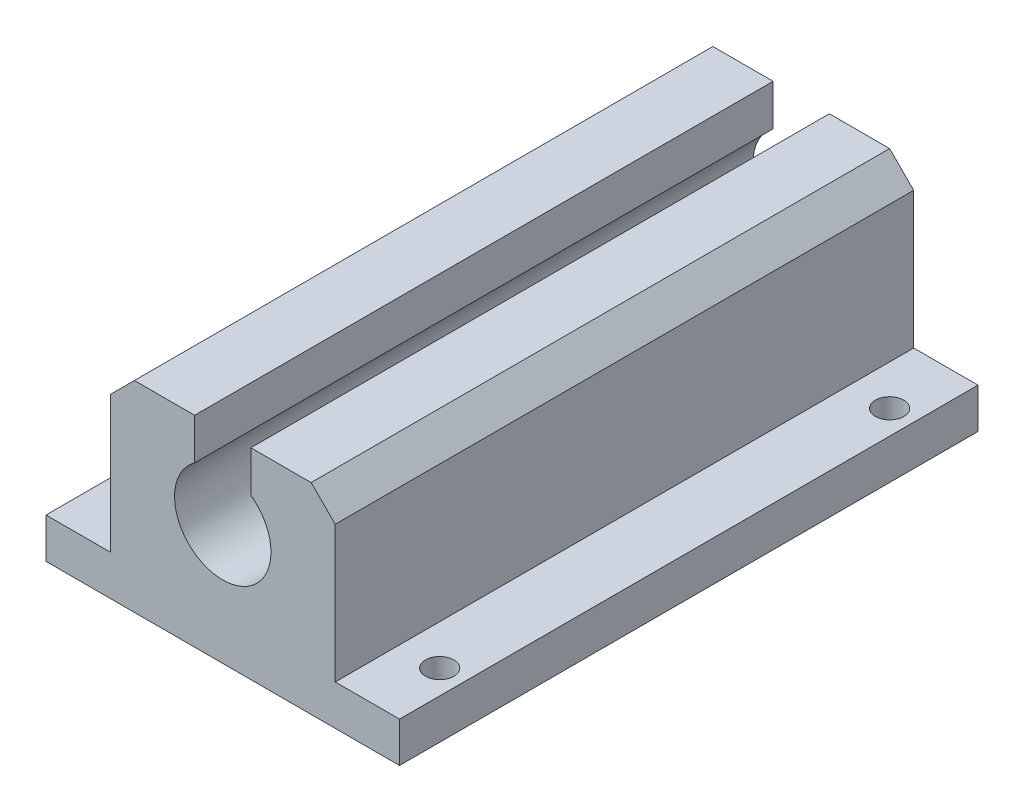
from build123d import *

# Parameters (mm, degrees)
EXTRUDE1_DEPTH         = 57.15
F_10_CLEARANCE_HOLE1_D = 5.6134
CHAMFER1_SIZE          = 4.7625


with BuildPart() as part:
    # Sketch1 → Extrude1 (new, symmetric)
    with BuildSketch(Plane.XY):
        with BuildLine():
            Line((22.225, 15.875), (5.55625, 15.875))
            Line((5.55625, 15.875), (5.55625, 7.736518011))
            ThreePointArc((5.55625, 7.736518011), (0, -9.525), (-5.55625, 7.736518011))
            Line((-5.55625, 7.736518011), (-5.55625, 15.875))
            Line((-5.55625, 15.875), (-22.225, 15.875))
            Line((-22.225, 15.875), (-22.225, -15.875))
            Line((-22.225, -15.875), (-34.925, -15.875))
            Line((-34.925, -15.875), (-34.925, -23.8125))
            Line((-34.925, -23.8125), (34.925, -23.8125))
            Line((34.925, -23.8125), (34.925, -15.875))
            Line((34.925, -15.875), (22.225, -15.875))
            Line((22.225, -15.875), (22.225, 15.875))
        make_face()
    extrude(amount=EXTRUDE1_DEPTH, both=True)

    # #10 Clearance Hole1 (through all)
    with Locations(Plane.XZ.offset(23.8125)):
        with Locations((-30.1625, -44.45), (30.1625, -44.45), (-30.1625, 44.45), (30.1625, 44.45)):
            Hole(F_10_CLEARANCE_HOLE1_D / 2)

    # Chamfer1
    chamfer1_edges = [part.edges().sort_by_distance(p)[0] for p in [
        (-22.225, 15.875, 0),
        (22.225, 15.875, 0),
    ]]
    chamfer(chamfer1_edges, length=CHAMFER1_SIZE)


solid = part.part
